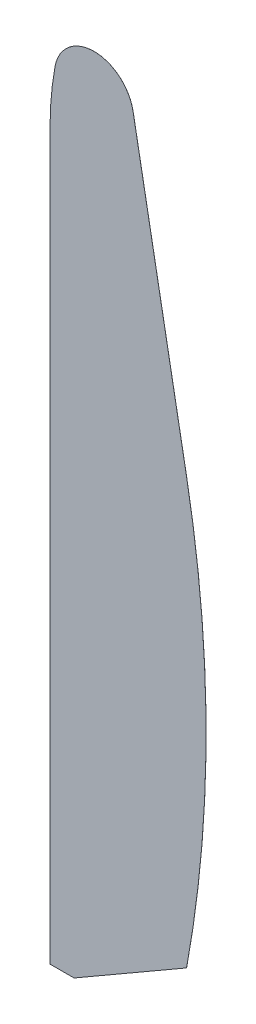
from build123d import *

# Parameters (mm, degrees)
BOSS_EXTRUDE1_DEPTH = 0.01


with BuildPart() as part:
    # Sketch1 → Boss-Extrude1 (new body)
    with BuildSketch(Plane(origin=(0, 0, 0), x_dir=(0, 1, 0), z_dir=(0, 0, 1))):
        with BuildLine():
            Line((0, 0), (151.125, 0))
            ThreePointArc((151.125, 0), (156.836329202, -0.261133035), (162.5, -1.042353105))
            ThreePointArc((162.5, -1.042353105), (169.260922019, -9.167353105), (162.5, -17.292353105))
            Line((162.5, -17.292353105), (102.198217376, -28.4375))
            ThreePointArc((102.198217376, -28.4375), (57.864932155, -32.5), (13.531646934, -28.4375))
            Line((13.531646934, -28.4375), (0, -5))
            Line((0, -5), (0, 0))
        make_face()
    extrude(amount=BOSS_EXTRUDE1_DEPTH)


solid = part.part
